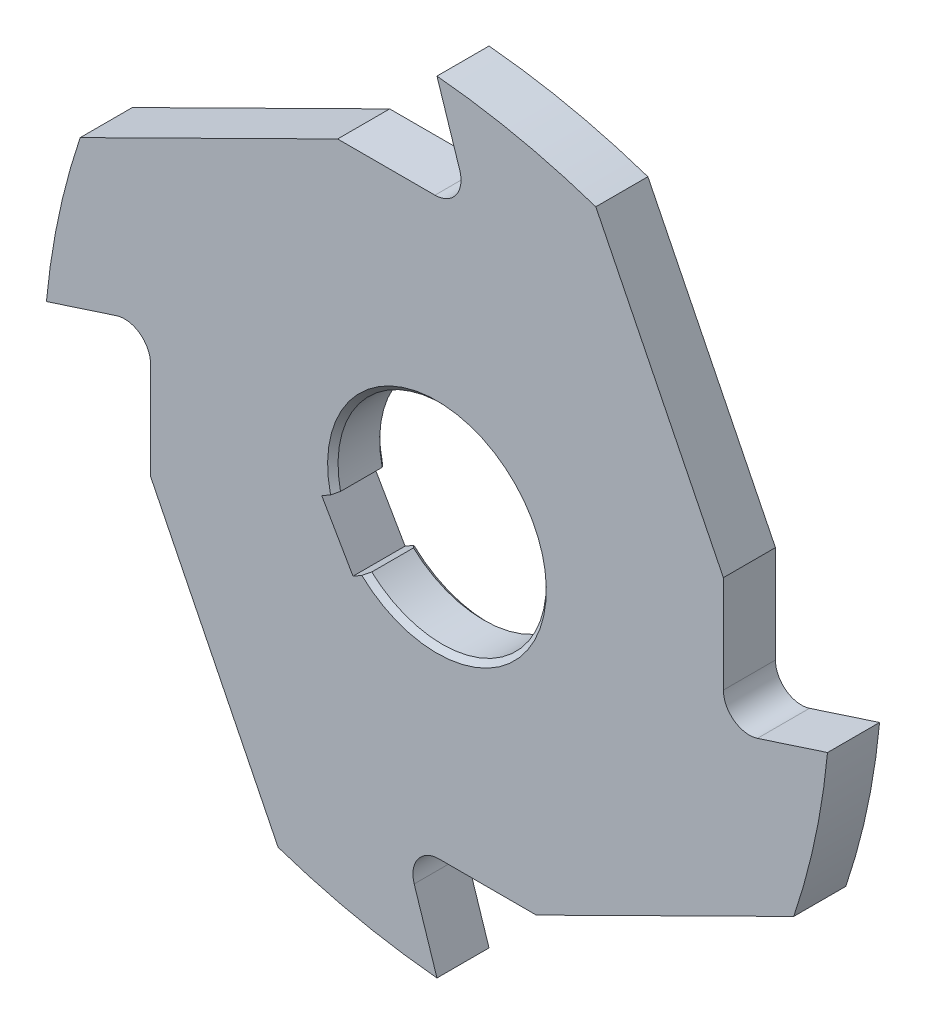
from build123d import *

# Parameters (mm, degrees)
BOSS_EXTRUDE1_DEPTH = 10
CHAMFER1_SIZE       = 1


with BuildPart() as part:
    # Sketch1 → Boss-Extrude1 (new body)
    with BuildSketch(Plane.XY):
        with BuildLine():
            ThreePointArc((4.371766904, 61.545084972), (3.661569294, 57.061073739), (-0.383515678, 55))
            Line((-0.383515678, 55), (-19.078784028, 55))
            Line((-19.078784028, 55), (-68.515909323, 30.505248231))
            ThreePointArc((-68.515909323, 30.505248231), (-72.64180115, 15.440491486), (-75, 0))
            Line((-75, 0), (-61.545084972, 4.371766904))
            ThreePointArc((-61.545084972, 4.371766904), (-57.061073739, 3.661569294), (-55, -0.383515678))
            Line((-55, -0.383515678), (-55, -19.078784028))
            Line((-55, -19.078784028), (-30.505248231, -68.515909323))
            ThreePointArc((-30.505248231, -68.515909323), (-15.440491486, -72.64180115), (0, -75))
            Line((0, -75), (-4.371766904, -61.545084972))
            ThreePointArc((-4.371766904, -61.545084972), (-3.661569294, -57.061073739), (0.383515678, -55))
            Line((0.383515678, -55), (19.078784028, -55))
            Line((19.078784028, -55), (68.515909323, -30.505248231))
            ThreePointArc((68.515909323, -30.505248231), (72.64180115, -15.440491486), (75, 0))
            Line((75, 0), (61.545084972, -4.371766904))
            ThreePointArc((61.545084972, -4.371766904), (57.061073739, -3.661569294), (55, 0.383515678))
            Line((55, 0.383515678), (55, 19.078784028))
            Line((55, 19.078784028), (30.505248231, 68.515909323))
            ThreePointArc((30.505248231, 68.515909323), (15.440491486, 72.64180115), (0, 75))
            Line((0, 75), (4.371766904, 61.545084972))
        make_face()
        with BuildLine():
            ThreePointArc((13.522711642, -14.735544437), (0, -20), (-13.522711642, -14.735544437))
            Line((-13.522711642, -14.735544437), (-16.120787853, -16.235544437))
            Line((-16.120787853, -16.235544437), (-22.120787853, -5.843239591))
            Line((-22.120787853, -5.843239591), (-19.522711642, -4.343239591))
            ThreePointArc((-19.522711642, -4.343239591), (-13.522711642, 14.735544437), (6, 19.078784028))
            ThreePointArc((6, 19.078784028), (19.522711642, 4.343239591), (13.522711642, -14.735544437))
        make_face(mode=Mode.SUBTRACT)
    extrude(amount=-BOSS_EXTRUDE1_DEPTH)

    # Chamfer1
    chamfer1_edges = [part.edges().sort_by_distance(p)[0] for p in [
        (17.320508076, -10, 0),
        (17.320508076, -10, -10),
    ]]
    chamfer(chamfer1_edges, length=CHAMFER1_SIZE)


solid = part.part
